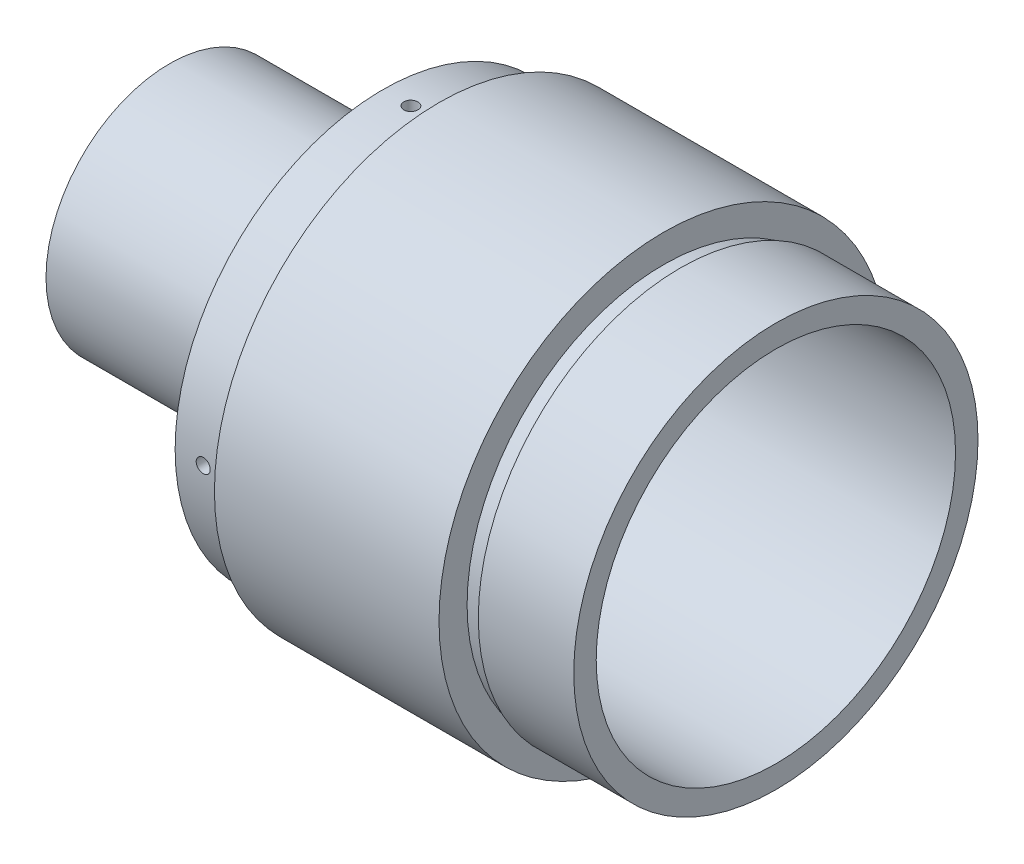
from build123d import *

# Parameters (mm, degrees)
IZIM12_R                = 1.6
KES_EKSTR_ZYON1_DEPTH   = 122.918005233
DAIRESEL_KAPLAMA1_COUNT = 6
KES_EKSTR_ZYON2_START   = 27
IZIM13_R                = 1.25
KES_EKSTR_ZYON2_DEPTH   = 10
DAIRESEL_KAPLAMA2_COUNT = 4


with BuildPart() as part:
    # Çizim1 → Döndür1 (revolve)
    with BuildSketch(Plane.XY, mode=Mode.PRIVATE) as d_nd_r1_sk:
        Polygon((-60, 40), (-60, 37), (-70, 37), (-70, 22), (-108, 22), (-108, 4), (-106, 4), (-106, 18.2), (-57, 18.2), (-57, 32), (0, 32), (0, 36), (-17, 36), (-17, 35), (-20, 35), (-20, 40), align=None)
    revolve(d_nd_r1_sk.sketch.rotate(Axis((-88.99, 0, 0), (1, 0, 0)), 90), axis=Axis((-88.99, 0, 0), (1, 0, 0)))

    # Çizim12 → Kes-Ekstrüzyon1 (cut, through all)
    with BuildSketch(Plane(origin=(0, 0, 0), x_dir=(0, 0, -1), z_dir=(1, 0, 0))):
        with Locations((12.5, 0)):
            Circle(IZIM12_R)
    kes_ekstr_zyon1 = extrude(amount=-KES_EKSTR_ZYON1_DEPTH, mode=Mode.SUBTRACT)

    # Dairesel Kaplama1: Kes-Ekstrüzyon1 ×6 about axis
    dairesel_kaplama1_axis = Axis((0, 0, 0), (1, 0, 0))
    for i in range(1, DAIRESEL_KAPLAMA1_COUNT):
        add(kes_ekstr_zyon1.rotate(dairesel_kaplama1_axis, i * 360 / DAIRESEL_KAPLAMA1_COUNT), mode=Mode.SUBTRACT)

    # Çizim13 → Kes-Ekstrüzyon2 (cut)
    with BuildSketch(Plane.XY.offset(KES_EKSTR_ZYON2_START)):
        with Locations((-65, 0)):
            Circle(IZIM13_R)
    kes_ekstr_zyon2 = extrude(amount=KES_EKSTR_ZYON2_DEPTH, mode=Mode.SUBTRACT)

    # Dairesel Kaplama2: Kes-Ekstrüzyon2 ×4 about axis
    dairesel_kaplama2_axis = Axis((0, 0, 0), (1, 0, 0))
    for i in range(1, DAIRESEL_KAPLAMA2_COUNT):
        add(kes_ekstr_zyon2.rotate(dairesel_kaplama2_axis, i * 360 / DAIRESEL_KAPLAMA2_COUNT), mode=Mode.SUBTRACT)


solid = part.part
